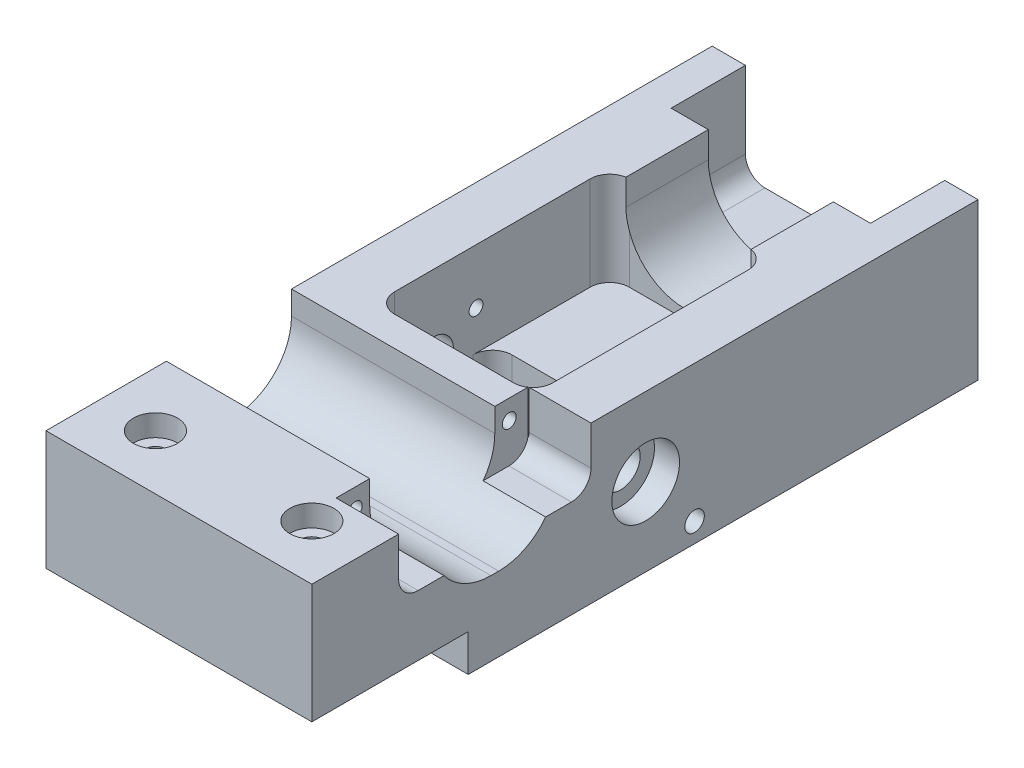
from build123d import *

# Parameters (mm, degrees)
BASE_DEPTH                    = 12.7
BASE_DEPTH_BACK               = 12.7
SKETCH1_W                     = 43.18
SKETCH1_H                     = 108.204
ACTUATORPLANECUT_DEPTH        = 6.0325
CENTERSLOT_DEPTH              = 60.619162222
CENTERSLOT_DEPTH_BACK         = 60.619162222
SKETCH5_W                     = 25.654
SKETCH5_H                     = 19.05
SHAFTGUIDE_REACH              = 113.065
SKETCH2_R                     = 4.7625
CENTERSLOTFILLET_R            = 3.175
GEARBOXPIT_DEPTH              = 11.176
FRONTCUTAWAY_DEPTH            = 15.24
GEARBOXSLOTSH_DEPTH           = 2.286
SKETCH55_R                    = 1.5875
GUIDEBARHOLE_DEPTH            = 71.376336961
PITCHSHAFTHOLE_DEPTH          = 60.619162279
PITCHSHAFTHOLE_DEPTH_BACK     = 60.619162279
SKETCH56_R                    = 3.175
SKETCH57_R                    = 5.5
BEARINGBORER_DEPTH            = 4.064
TOGGLEASSEMHOLES_D            = 2.7051
TOGGLEASSEMHOLES_DEPTH        = 9.398
TOGGLEASSEMHOLES_TIP          = 0.81269403
PITCHMOTORSLOT_DEPTH          = 71.37633704
PITCHMOTORMOUNTINGSLOTS_DEPTH = 10.16
PITCHMOTORMOUNTINGHOLES_D     = 2.2606
PITCHMOTORMOUNTINGHOLES_DEPTH = 7.5946
PITCHMOTORMOUNTINGHOLES_TIP   = 0.679152758
GEARBOXMOUNTINGHOLES_D        = 2.7051
GEARBOXMOUNTINGHOLES_DEPTH    = 9.398
GEARBOXMOUNTINGHOLES_TIP      = 0.81269403
CAPMOUNTINGHOLES_D            = 3.6576
CAPMOUNTINGHOLES_CBORE_D      = 7.14502
CAPMOUNTINGHOLES_CBORE_DEPTH  = 3.5052
ENCODERMOUNTINGHOLES_D        = 2.2606
ENCODERMOUNTINGHOLES_DEPTH    = 10.1346
ENCODERMOUNTINGHOLES_TIP      = 0.679152758
ROLLMOTORSLOT_REACH           = 113.065
ROLLMOTORMOUNTINGSLOTS_DEPTH  = 12.065
ROLLMOTORMOUNTINGHOLES_D      = 2.2606
ROLLMOTORMOUNTINGHOLES_DEPTH  = 7.62
ROLLMOTORMOUNTINGHOLES_TIP    = 0.679152758


with BuildPart() as part:
    # Sketch1 → Base (new, two sides: drawn at the far end of the back side and taken through both)
    with BuildSketch(Plane(origin=(0, 0, 0), x_dir=(1, 0, 0), z_dir=(0, 1, 0)).offset(-BASE_DEPTH_BACK)):
        Rectangle(SKETCH1_W, SKETCH1_H)
    extrude(amount=BASE_DEPTH + BASE_DEPTH_BACK)

    # Sketch3 → ActuatorPlaneCut (cut)
    with BuildSketch(Plane(origin=(0, -12.7, 0), x_dir=(-1, 0, 0), z_dir=(0, -1, 0))):
        Polygon((10.922, -28.702), (16.256, -28.702), (21.59, -28.702), (21.59, -54.102), (-21.59, -54.102), (-21.59, -28.702), (-10.922, -28.702), (-10.922, -11.176), (10.922, -11.176), align=None)
    extrude(amount=-ACTUATORPLANECUT_DEPTH, mode=Mode.SUBTRACT)

    # Sketch5 → CenterSlot (cut, two sides: drawn at the far end of the back side and taken through both)
    with BuildSketch(Plane(origin=(0, 0, 0), x_dir=(1, 0, 0), z_dir=(0, 1, 0)).offset(-CENTERSLOT_DEPTH_BACK)):
        with Locations((0, 0.127)):
            Rectangle(SKETCH5_W, SKETCH5_H)
    extrude(amount=CENTERSLOT_DEPTH + CENTERSLOT_DEPTH_BACK, mode=Mode.SUBTRACT)

    # Sketch2 → ShaftGuide (cut, up to next)
    with BuildSketch(Plane(origin=(0, 0, -54.102), x_dir=(-1, 0, 0), z_dir=(0, 0, -1)), mode=Mode.PRIVATE) as shaftguide_sk1:
        with Locations((0, -12.7)):
            Circle(SKETCH2_R)
    shaftguide_tool1 = extrude(shaftguide_sk1.sketch, amount=-SHAFTGUIDE_REACH, mode=Mode.PRIVATE) & part.part
    add(shaftguide_tool1.solids().sort_by_distance((0, -12.7, -54.102))[0], mode=Mode.SUBTRACT)

    # CenterSlotFillet
    centerslotfillet_edges = [part.edges().sort_by_distance(p)[0] for p in [
        (-12.827, 0, -9.652),
        (-12.827, 0, 9.398),
        (12.827, 0, 9.398),
        (12.827, 0, -9.652),
    ]]
    fillet(centerslotfillet_edges, radius=CENTERSLOTFILLET_R)

    # Sketch40 → GearBoxPit (cut)
    with BuildSketch(Plane.XZ.offset(12.7)):
        with BuildLine():
            Line((10.922, 6.858), (-10.922, 6.858))
            Line((-10.922, 6.858), (-10.922, 25.527))
            ThreePointArc((-10.922, 25.527), (-9.99206403, 27.77206403), (-7.747, 28.702))
            Line((-7.747, 28.702), (7.747, 28.702))
            ThreePointArc((7.747, 28.702), (9.99206403, 27.77206403), (10.922, 25.527))
            Line((10.922, 25.527), (10.922, 6.858))
        make_face()
    extrude(amount=-GEARBOXPIT_DEPTH, mode=Mode.SUBTRACT)

    # Sketch60 → FrontCutaway (cut)
    with BuildSketch(Plane(origin=(0, 12.7, 0), x_dir=(1, 0, 0), z_dir=(0, 1, 0))):
        with BuildLine():
            Line((-12.827, 6.477), (12.827, 6.477))
            Line((12.827, 6.477), (12.827, 25.527))
            ThreePointArc((12.827, 25.527), (11.89706403, 27.77206403), (9.652, 28.702))
            Line((9.652, 28.702), (-9.652, 28.702))
            ThreePointArc((-9.652, 28.702), (-11.89706403, 27.77206403), (-12.827, 25.527))
            Line((-12.827, 25.527), (-12.827, 6.477))
        make_face()
    extrude(amount=-FRONTCUTAWAY_DEPTH, mode=Mode.SUBTRACT)

    # Sketch67 → GearBoxSlotsH (cut)
    with BuildSketch(Plane(origin=(0, -12.7, 0), x_dir=(-1, 0, 0), z_dir=(0, -1, 0))):
        with BuildLine():
            Line((-12.3825, -12.811125), (12.3825, -12.811125))
            ThreePointArc((12.3825, -12.811125), (12.779375, -13.208), (12.3825, -13.604875))
            Line((12.3825, -13.604875), (-12.3825, -13.604875))
            ThreePointArc((-12.3825, -13.604875), (-12.779375, -13.208), (-12.3825, -12.811125))
        make_face()
        with BuildLine():
            Line((-12.3825, -23.479125), (12.3825, -23.479125))
            ThreePointArc((12.3825, -23.479125), (12.779375, -23.876), (12.3825, -24.272875))
            Line((12.3825, -24.272875), (-12.3825, -24.272875))
            ThreePointArc((-12.3825, -24.272875), (-12.779375, -23.876), (-12.3825, -23.479125))
        make_face()
    extrude(amount=-GEARBOXSLOTSH_DEPTH, mode=Mode.SUBTRACT)

    # Sketch55 → GuideBarHole (cut, through all)
    with BuildSketch(Plane.ZY.offset(21.59)):
        with Locations((-8.0645, -9.525)):
            Circle(SKETCH55_R)
    extrude(amount=-GUIDEBARHOLE_DEPTH, mode=Mode.SUBTRACT)

    # Sketch56 → PitchShaftHole (cut, two sides: drawn at the far end of the back side and taken through both)
    with BuildSketch(Plane(origin=(0, 0, 0), x_dir=(0, 0, -1), z_dir=(1, 0, 0)).offset(-PITCHSHAFTHOLE_DEPTH_BACK)):
        with Locations((0.127, 0)):
            Circle(SKETCH56_R)
    extrude(amount=PITCHSHAFTHOLE_DEPTH + PITCHSHAFTHOLE_DEPTH_BACK, mode=Mode.SUBTRACT)

    # Sketch57 → BearingBoreR (cut)
    with BuildSketch(Plane.ZY.offset(21.59)):
        with Locations((-0.127, 0)):
            Circle(SKETCH57_R)
    bearingborer = extrude(amount=-BEARINGBORER_DEPTH, mode=Mode.SUBTRACT)

    # BearingBoreL: BearingBoreR across plane
    add(bearingborer.mirror(Plane(origin=(0, 0, 0), x_dir=(0, 0, 1), z_dir=(1, 0, 0))), mode=Mode.SUBTRACT)

    # ToggleAssemHoles
    with Locations(Plane(origin=(0, -12.7, 0), x_dir=(-1, 0, 0), z_dir=(0, -1, 0))):
        with Locations((15.875, 22.352), (-15.875, 22.352)):
            Hole(TOGGLEASSEMHOLES_D / 2, depth=TOGGLEASSEMHOLES_DEPTH)
            with Locations((0, 0, -(TOGGLEASSEMHOLES_DEPTH + TOGGLEASSEMHOLES_TIP / 2))):  # 118° drill point
                Cone(0, TOGGLEASSEMHOLES_D / 2, TOGGLEASSEMHOLES_TIP, mode=Mode.SUBTRACT)

    # Sketch62 → PitchMotorSlot (cut, through all)
    with BuildSketch(Plane.ZY.offset(21.59)):
        with BuildLine():
            Line((14.224, 9.525), (14.224, 12.7))
            Line((14.224, 12.7), (34.544, 12.7))
            Line((34.544, 12.7), (34.544, 9.525))
            Line((34.544, 9.525), (34.544, 8.89))
            ThreePointArc((34.544, 8.89), (31.754192091, 2.154807909), (25.019, -0.635))
            Line((25.019, -0.635), (23.749, -0.635))
            ThreePointArc((23.749, -0.635), (17.013807909, 2.154807909), (14.224, 8.89))
            Line((14.224, 8.89), (14.224, 9.525))
        make_face()
    extrude(amount=-PITCHMOTORSLOT_DEPTH, mode=Mode.SUBTRACT)

    # Sketch63 → PitchMotorMountingSlots (cut)
    with BuildSketch(Plane.ZY.offset(-21.59)):
        with BuildLine():
            Line((8.763, 12.7), (40.005, 12.7))
            Line((40.005, 12.7), (40.005, 6.35))
            ThreePointArc((40.005, 6.35), (39.07506403, 4.10493597), (36.83, 3.175))
            Line((36.83, 3.175), (11.938, 3.175))
            ThreePointArc((11.938, 3.175), (9.69293597, 4.10493597), (8.763, 6.35))
            Line((8.763, 6.35), (8.763, 12.7))
        make_face()
    extrude(amount=PITCHMOTORMOUNTINGSLOTS_DEPTH, mode=Mode.SUBTRACT)

    # PitchMotorMountingHoles
    with Locations(Plane(origin=(11.43, 0, 0), x_dir=(0, 0, -1), z_dir=(1, 0, 0))):
        with Locations((-36.884, 9.525), (-11.884, 9.525)):
            Hole(PITCHMOTORMOUNTINGHOLES_D / 2, depth=PITCHMOTORMOUNTINGHOLES_DEPTH)
            with Locations((0, 0, -(PITCHMOTORMOUNTINGHOLES_DEPTH + PITCHMOTORMOUNTINGHOLES_TIP / 2))):  # 118° drill point
                Cone(0, PITCHMOTORMOUNTINGHOLES_D / 2, PITCHMOTORMOUNTINGHOLES_TIP, mode=Mode.SUBTRACT)

    # GearBoxMountingHoles
    with Locations(Plane(origin=(0, -12.7, 0), x_dir=(-1, 0, 0), z_dir=(0, -1, 0))):
        with Locations((-16.256, -18.542), (16.256, -18.542)):
            Hole(GEARBOXMOUNTINGHOLES_D / 2, depth=GEARBOXMOUNTINGHOLES_DEPTH)
            with Locations((0, 0, -(GEARBOXMOUNTINGHOLES_DEPTH + GEARBOXMOUNTINGHOLES_TIP / 2))):  # 118° drill point
                Cone(0, GEARBOXMOUNTINGHOLES_D / 2, GEARBOXMOUNTINGHOLES_TIP, mode=Mode.SUBTRACT)

    # CapMountingHoles (through all)
    with Locations(Plane(origin=(-0.837932951, 12.7, 8.633720573), x_dir=(-1, 0, 0), z_dir=(0, 1, 0))):
        with Locations((-13.537932951, 36.578279427), (11.862067049, 36.578279427)):
            CounterBoreHole(CAPMOUNTINGHOLES_D / 2, CAPMOUNTINGHOLES_CBORE_D / 2, CAPMOUNTINGHOLES_CBORE_DEPTH)

    # EncoderMountingHoles
    with Locations(Plane.ZY.offset(21.59)):
        with Locations((6.731, 3.81), (-6.985, 3.81)):
            Hole(ENCODERMOUNTINGHOLES_D / 2, depth=ENCODERMOUNTINGHOLES_DEPTH)
            with Locations((0, 0, -(ENCODERMOUNTINGHOLES_DEPTH + ENCODERMOUNTINGHOLES_TIP / 2))):  # 118° drill point
                Cone(0, ENCODERMOUNTINGHOLES_D / 2, ENCODERMOUNTINGHOLES_TIP, mode=Mode.SUBTRACT)

    # Sketch81 → RollMotorSlot (cut, up to next)
    with BuildSketch(Plane(origin=(0, 0, -54.102), x_dir=(-1, 0, 0), z_dir=(0, 0, -1)), mode=Mode.PRIVATE) as rollmotorslot_sk1:
        with BuildLine():
            Line((10.16, 12.7), (-10.16, 12.7))
            Line((-10.16, 12.7), (-10.16, 8.46582))
            ThreePointArc((-10.16, 8.46582), (-7.370192091, 1.730627909), (-0.635, -1.05918))
            Line((-0.635, -1.05918), (0.635, -1.05918))
            ThreePointArc((0.635, -1.05918), (7.370192091, 1.730627909), (10.16, 8.46582))
            Line((10.16, 8.46582), (10.16, 12.7))
        make_face()
    rollmotorslot_tool1 = extrude(rollmotorslot_sk1.sketch, amount=-ROLLMOTORSLOT_REACH, mode=Mode.PRIVATE) & part.part
    add(rollmotorslot_tool1.solids().sort_by_distance((0, 6.589347, -54.102))[0], mode=Mode.SUBTRACT)

    # Sketch84 → RollMotorMountingSlots (cut)
    with BuildSketch(Plane(origin=(0, 0, -54.102), x_dir=(-1, 0, 0), z_dir=(0, 0, -1))):
        with BuildLine():
            Line((16.1925, 12.7), (-16.1925, 12.7))
            Line((-16.1925, 12.7), (-16.1925, 0.21082))
            ThreePointArc((-16.1925, 0.21082), (-15.26256403, -2.03424403), (-13.0175, -2.96418))
            Line((-13.0175, -2.96418), (13.0175, -2.96418))
            ThreePointArc((13.0175, -2.96418), (15.26256403, -2.03424403), (16.1925, 0.21082))
            Line((16.1925, 0.21082), (16.1925, 12.7))
        make_face()
    extrude(amount=-ROLLMOTORMOUNTINGSLOTS_DEPTH, mode=Mode.SUBTRACT)

    # RollMotorMountingHoles
    with Locations(Plane(origin=(0, 0, -42.037), x_dir=(-1, 0, 0), z_dir=(0, 0, -1))):
        with Locations((12.5, 8.46582), (-12.5, 8.46582)):
            Hole(ROLLMOTORMOUNTINGHOLES_D / 2, depth=ROLLMOTORMOUNTINGHOLES_DEPTH)
            with Locations((0, 0, -(ROLLMOTORMOUNTINGHOLES_DEPTH + ROLLMOTORMOUNTINGHOLES_TIP / 2))):  # 118° drill point
                Cone(0, ROLLMOTORMOUNTINGHOLES_D / 2, ROLLMOTORMOUNTINGHOLES_TIP, mode=Mode.SUBTRACT)


solid = part.part
